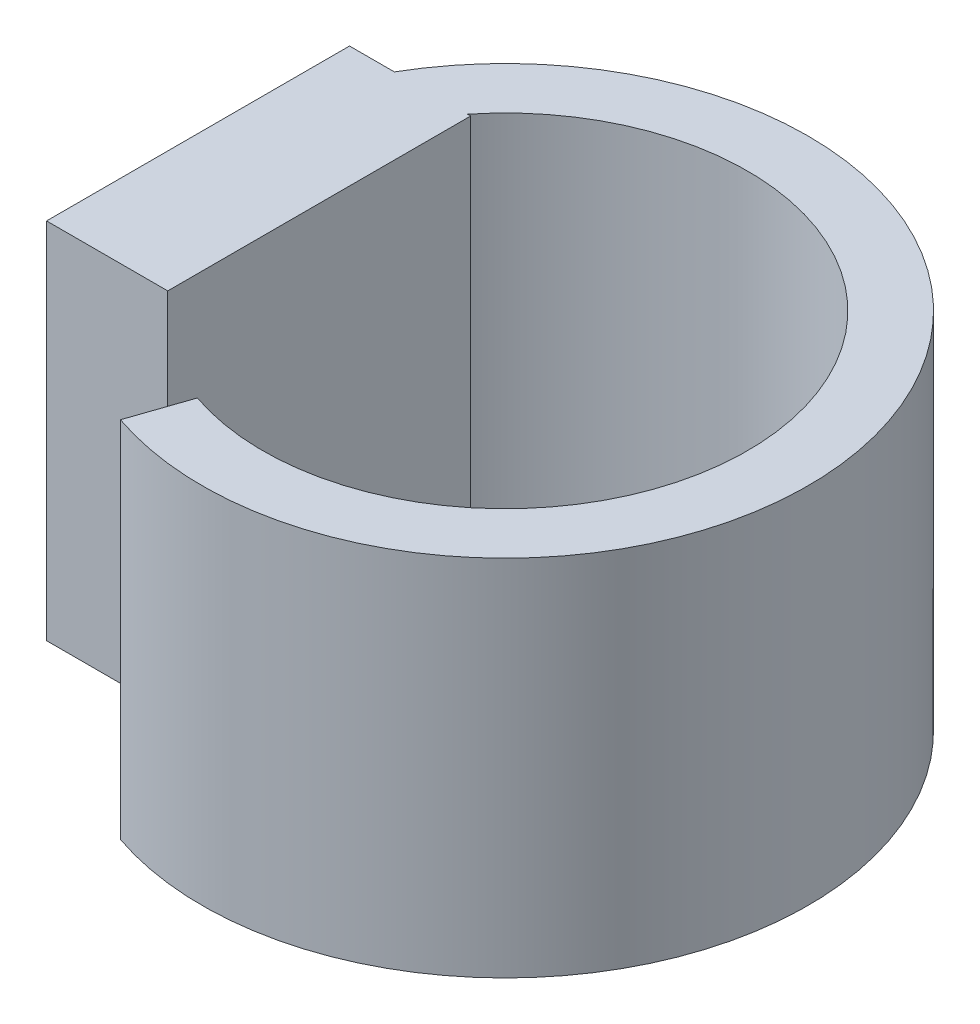
from build123d import *

# Parameters (mm, degrees)
BOSS_EXTRUDE1_DEPTH = 12


with BuildPart() as part:
    # Sketch1 → Boss-Extrude1 (new body)
    with BuildSketch(Plane(origin=(0, 0, 0), x_dir=(1, 0, 0), z_dir=(0, 1, 0))):
        with BuildLine():
            Line((7.550302589, -2.572347999), (6.903132735, -4.464746261))
            ThreePointArc((6.903132735, -4.464746261), (19.502585792, 8.507647316), (1.480319122, 10))
            Line((1.480319122, 10), (0, 10))
            Line((0, 10), (0, 0))
            Line((0, 0), (4, 0))
            Line((4, 0), (4, 10))
            Line((4, 10), (3.89619073, 10))
            ThreePointArc((3.89619073, 10), (17.821084722, 7.230023098), (7.550302589, -2.572347999))
        make_face()
    extrude(amount=BOSS_EXTRUDE1_DEPTH)


solid = part.part
